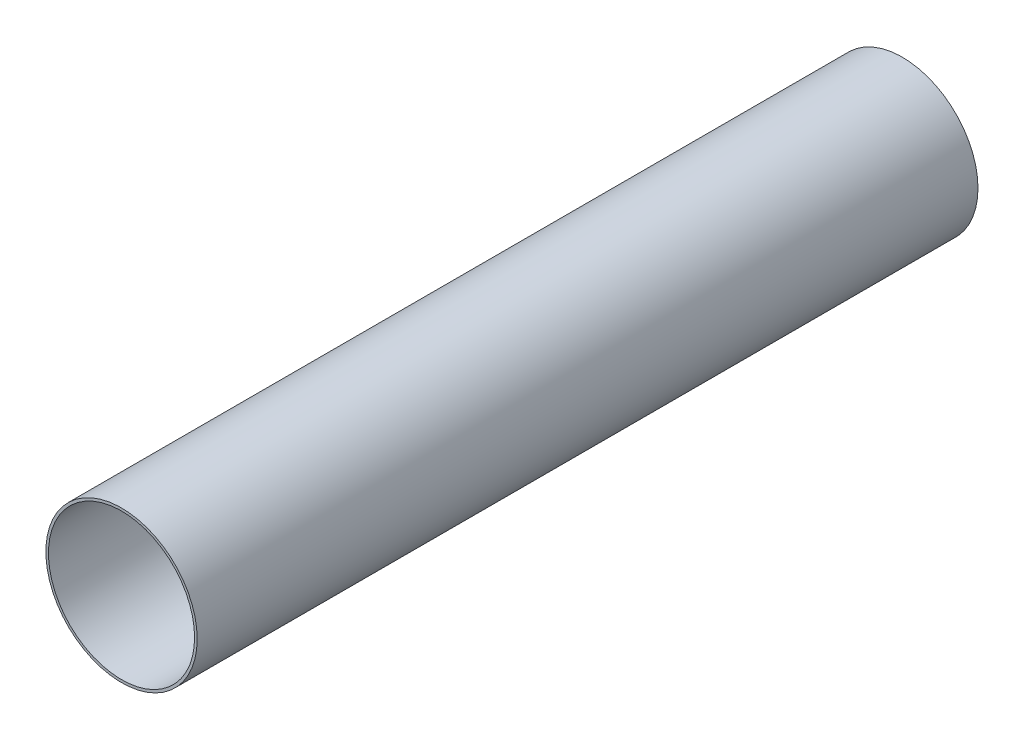
from build123d import *

# Parameters (mm, degrees)
CROQUIS1_R              = 145.37
CROQUIS1_R_2            = 140.37
SALIENTE_EXTRUIR1_DEPTH = 1500


with BuildPart() as part:
    # Croquis1 → Saliente-Extruir1 (new body)
    with BuildSketch(Plane(origin=(0, 0, 0), x_dir=(0, 1, 0), z_dir=(0, 0, 1))):
        with Locations(Location((0, 0, 0), (0, 0, 270))):
            Circle(CROQUIS1_R)
        with Locations(Location((0, 0, 0), (0, 0, 270))):
            Circle(CROQUIS1_R_2, mode=Mode.SUBTRACT)
    extrude(amount=SALIENTE_EXTRUIR1_DEPTH)


solid = part.part
